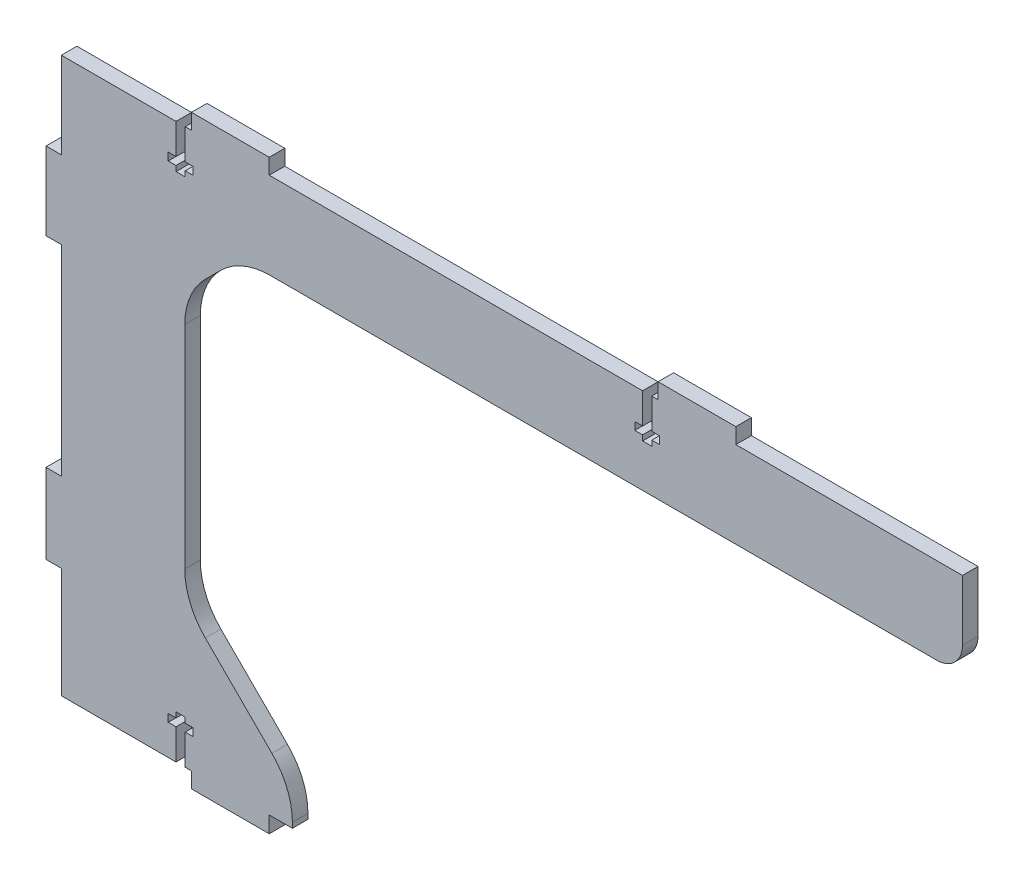
from build123d import *

# Parameters (mm, degrees)
BOSS_EXTRUDE1_DEPTH = 5.08


with BuildPart() as part:
    # Sketch1 → Boss-Extrude1 (new body)
    with BuildSketch(Plane.XY):
        with BuildLine():
            Line((-114.376804032, 88.667051475), (-139.776804032, 88.667051475))
            Line((-139.776804032, 88.667051475), (-139.776804032, 93.747051475))
            Line((-139.776804032, 93.747051475), (-141.822276948, 93.747051475))
            Line((-141.822276948, 93.747051475), (-141.822276948, 103.713000769))
            Line((-141.822276948, 103.713000769), (-139.282276948, 103.713000769))
            Line((-139.282276948, 103.713000769), (-139.282276948, 106.213000769))
            Line((-139.282276948, 106.213000769), (-141.822276948, 106.213000769))
            Line((-141.822276948, 106.213000769), (-141.822276948, 107.947051475))
            Line((-141.822276948, 107.947051475), (-144.822276948, 107.947051475))
            Line((-144.822276948, 107.947051475), (-144.822276948, 106.213000769))
            Line((-144.822276948, 106.213000769), (-147.362276948, 106.213000769))
            Line((-147.362276948, 106.213000769), (-147.362276948, 103.713000769))
            Line((-147.362276948, 103.713000769), (-144.822276948, 103.713000769))
            Line((-144.822276948, 103.713000769), (-144.822276948, 93.747051475))
            Line((-144.822276948, 93.747051475), (-182.269486813, 93.747051475))
            Line((-182.269486813, 93.747051475), (-182.269486813, 129.81075177))
            Line((-182.269486813, 129.81075177), (-187.286518352, 129.81075177))
            Line((-187.286518352, 129.81075177), (-187.286518352, 155.871504364))
            Line((-187.286518352, 155.871504364), (-182.269486813, 155.871504364))
            Line((-182.269486813, 155.871504364), (-182.269486813, 212.837023738))
            Line((-182.269486813, 212.837023738), (-182.269486813, 221.371776332))
            Line((-182.269486813, 221.371776332), (-187.286518352, 221.371776332))
            Line((-187.286518352, 221.371776332), (-187.286518352, 246.771776332))
            Line((-187.286518352, 246.771776332), (-182.269486813, 246.771776332))
            Line((-182.269486813, 246.771776332), (-182.269486813, 274.961476627))
            Line((-182.269486813, 274.961476627), (-144.822276948, 274.961476627))
            Line((-144.822276948, 274.961476627), (-144.822276948, 264.995527332))
            Line((-144.822276948, 264.995527332), (-147.362276948, 264.995527332))
            Line((-147.362276948, 264.995527332), (-147.362276948, 262.495527332))
            Line((-147.362276948, 262.495527332), (-144.822276948, 262.495527332))
            Line((-144.822276948, 262.495527332), (-144.822276948, 260.761476627))
            Line((-144.822276948, 260.761476627), (-141.822276948, 260.761476627))
            Line((-141.822276948, 260.761476627), (-141.822276948, 262.495527332))
            Line((-141.822276948, 262.495527332), (-139.282276948, 262.495527332))
            Line((-139.282276948, 262.495527332), (-139.282276948, 264.995527332))
            Line((-139.282276948, 264.995527332), (-141.822276948, 264.995527332))
            Line((-141.822276948, 264.995527332), (-141.822276948, 274.961476627))
            Line((-141.822276948, 274.961476627), (-139.776804032, 274.961476627))
            Line((-139.776804032, 274.961476627), (-139.776804032, 280.041476627))
            Line((-139.776804032, 280.041476627), (-114.376804032, 280.041476627))
            Line((-114.376804032, 280.041476627), (-114.376804032, 274.961476627))
            Line((-114.376804032, 274.961476627), (-106.810604162, 274.961476627))
            Line((-106.810604162, 274.961476627), (7.577723052, 274.961476627))
            Line((7.577723052, 274.961476627), (7.577723052, 264.995527332))
            Line((7.577723052, 264.995527332), (5.037723052, 264.995527332))
            Line((5.037723052, 264.995527332), (5.037723052, 262.495527332))
            Line((5.037723052, 262.495527332), (7.577723052, 262.495527332))
            Line((7.577723052, 262.495527332), (7.577723052, 260.761476627))
            Line((7.577723052, 260.761476627), (10.577723052, 260.761476627))
            Line((10.577723052, 260.761476627), (10.577723052, 262.495527332))
            Line((10.577723052, 262.495527332), (13.117723052, 262.495527332))
            Line((13.117723052, 262.495527332), (13.117723052, 264.995527332))
            Line((13.117723052, 264.995527332), (10.577723052, 264.995527332))
            Line((10.577723052, 264.995527332), (10.577723052, 274.961476627))
            Line((10.577723052, 274.961476627), (12.623195968, 274.961476627))
            Line((12.623195968, 274.961476627), (12.623195968, 280.041476627))
            Line((12.623195968, 280.041476627), (38.023195968, 280.041476627))
            Line((38.023195968, 280.041476627), (38.023195968, 274.961476627))
            Line((38.023195968, 274.961476627), (112.050844633, 274.961476627))
            Line((112.050844633, 274.961476627), (112.050844633, 255.184968454))
            ThreePointArc((112.050844633, 255.184968454), (109.586677712, 249.235943253), (103.63765251, 246.771776332))
            Line((103.63765251, 246.771776332), (-114.102022694, 246.771776332))
            ThreePointArc((-114.102022694, 246.771776332), (-122.850165958, 245.031662445), (-130.266483712, 240.076237349))
            Line((-130.266483712, 240.076237349), (-135.253616385, 235.089104676))
            ThreePointArc((-135.253616385, 235.089104676), (-140.20904148, 227.672786922), (-141.949155367, 218.924643658))
            Line((-141.949155367, 218.924643658), (-141.949155367, 149.783884443))
            ThreePointArc((-141.949155367, 149.783884443), (-140.20904148, 141.035741179), (-135.253616385, 133.619423425))
            Line((-135.253616385, 133.619423425), (-113.506143144, 111.871950184))
            ThreePointArc((-113.506143144, 111.871950184), (-108.550718048, 104.45563243), (-106.810604162, 95.707489166))
            Line((-106.810604162, 95.707489166), (-106.810604162, 93.993771805))
            Line((-106.810604162, 93.993771805), (-114.376804032, 93.993771805))
            Line((-114.376804032, 93.993771805), (-114.376804032, 88.93863086))
            Line((-114.376804032, 88.93863086), (-114.376804032, 88.667051475))
        make_face()
    extrude(amount=BOSS_EXTRUDE1_DEPTH)


solid = part.part
